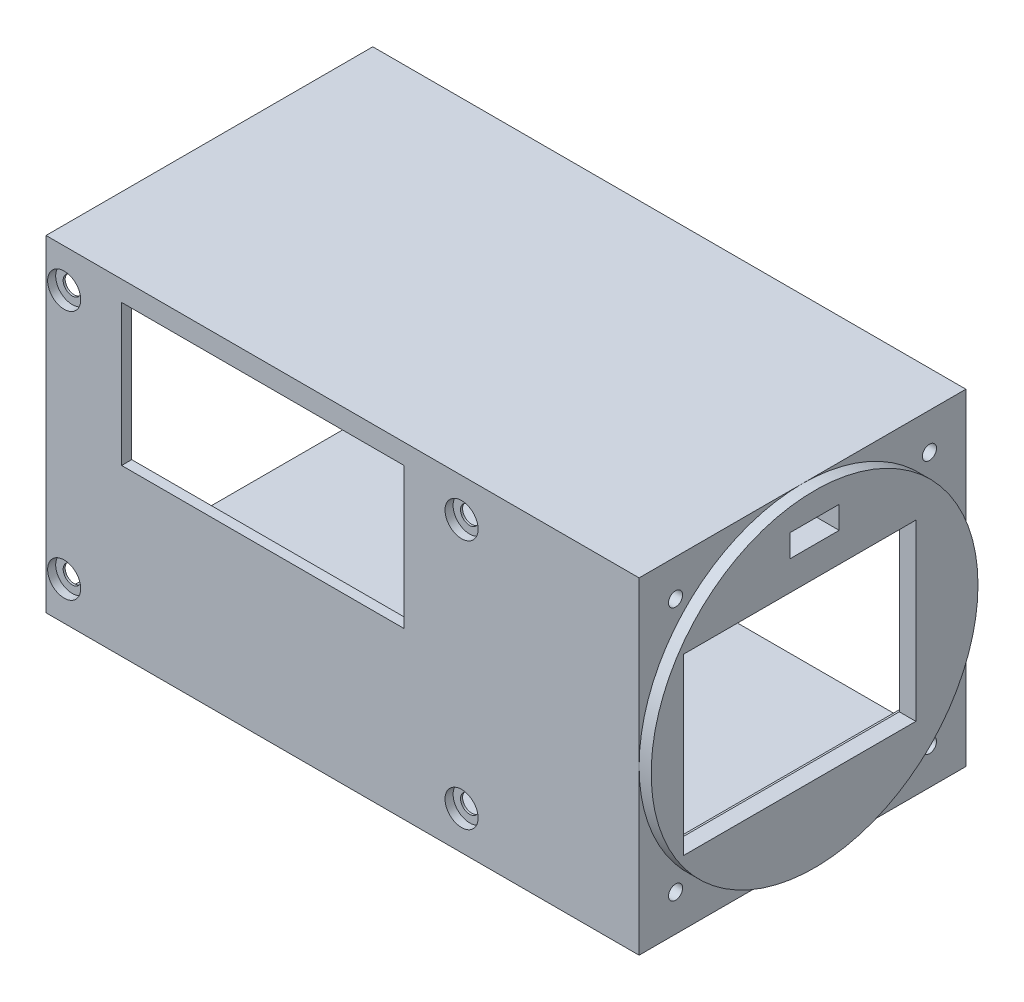
from build123d import *

# Parameters (mm, degrees)
SZKIC1_W                    = 57.6
SZKIC1_H                    = 43.2
DODANIE_WYCI_GNI_CIE1_DEPTH = 8
DODANIE_WYCI_GNI_CIE2_DEPTH = 5
SZKIC2_W                    = 69.32
SZKIC2_H                    = 50.12
SZKIC2_W_2                  = 57.6
SZKIC2_H_2                  = 43.2
WYTNIJ_WYCI_GNI_CIE1_DEPTH  = 3.9
SZKIC2_4_W                  = 81
SZKIC2_4_H                  = 81
SZKIC2_4_W_2                = 73.3
SZKIC2_4_H_2                = 55.32
DODANIE_WYCI_GNI_CIE3_DEPTH = 2
DODANIE_WYCI_GNI_CIE4_DEPTH = 140
WYTNIJ_WYCI_GNI_CIE2_REACH  = 184.445
SZKIC5_R                    = 2.25
SZKIC6_R                    = 4.1
WYTNIJ_WYCI_GNI_CIE3_DEPTH  = 2
WYTNIJ_WYCI_GNI_CIE4_REACH  = 184.445
SZKIC7_W                    = 70
SZKIC7_H                    = 35
WYTNIJ_WYCI_GNI_CIE5_REACH  = 188.363
SZKIC8_R                    = 1.75
WYTNIJ_WYCI_GNI_CIE6_REACH  = 190.738
SZKIC9_W                    = 12.2
SZKIC9_H                    = 5.6
SZKIC10_W                   = 140
SZKIC10_H                   = 78
WYTNIJ_WYCI_GNI_CIE7_DEPTH  = 0.5
SZKIC11_W                   = 140
SZKIC11_H                   = 78
WYTNIJ_WYCI_GNI_CIE8_DEPTH  = 0.5
WYTNIJ_WYCI_GNI_CIE9_DEPTH  = 0.5
WYTNIJ_WYCI_GNI_CIE10_DEPTH = 0.5


with BuildPart() as part:
    # Szkic1 → Dodanie-wyciągnięcie1 (new body)
    with BuildSketch(Plane(origin=(0, 0, 0), x_dir=(0, 0, -1), z_dir=(1, 0, 0))):
        with BuildLine():
            ThreePointArc((81, 40.5), (69.137824638, 69.137824638), (40.5, 81))
            ThreePointArc((40.5, 81), (11.862175362, 69.137824638), (0, 40.5))
            ThreePointArc((0, 40.5), (11.862175362, 11.862175362), (40.5, 0))
            ThreePointArc((40.5, 0), (69.137824638, 11.862175362), (81, 40.5))
        make_face()
        with Locations((36.8, 40.5)):
            Rectangle(SZKIC1_W, SZKIC1_H, mode=Mode.SUBTRACT)
    extrude(amount=DODANIE_WYCI_GNI_CIE1_DEPTH)

    # Szkic1<3> → Dodanie-wyciągnięcie2 (add)
    with BuildSketch(Plane(origin=(0, 0, 0), x_dir=(0, 0, -1), z_dir=(1, 0, 0))):
        with BuildLine():
            Line((40.5, 81), (0, 81))
            Line((0, 81), (0, 40.5))
            ThreePointArc((0, 40.5), (11.862175362, 69.137824638), (40.5, 81))
        make_face()
        with BuildLine():
            Line((81, 81), (40.5, 81))
            ThreePointArc((40.5, 81), (69.137824638, 69.137824638), (81, 40.5))
            Line((81, 40.5), (81, 81))
        make_face()
        with BuildLine():
            ThreePointArc((40.5, 0), (11.862175362, 11.862175362), (0, 40.5))
            Line((0, 40.5), (0, 0))
            Line((0, 0), (40.5, 0))
        make_face()
        with BuildLine():
            Line((81, 0), (81, 40.5))
            ThreePointArc((81, 40.5), (69.137824638, 11.862175362), (40.5, 0))
            Line((40.5, 0), (81, 0))
        make_face()
    extrude(amount=DODANIE_WYCI_GNI_CIE2_DEPTH)

    # Szkic2 → Wytnij-wyciągnięcie1 (cut)
    with BuildSketch(Plane.ZY):
        with Locations((-39.6, 40.5)):
            Rectangle(SZKIC2_W, SZKIC2_H)
        with Locations((-36.8, 40.5)):
            Rectangle(SZKIC2_W_2, SZKIC2_H_2, mode=Mode.SUBTRACT)
    extrude(amount=-WYTNIJ_WYCI_GNI_CIE1_DEPTH, mode=Mode.SUBTRACT)

    # Szkic2<4> → Dodanie-wyciągnięcie3 (add)
    with BuildSketch(Plane.ZY):
        with Locations((-40.5, 40.5)):
            Rectangle(SZKIC2_4_W, SZKIC2_4_H)
        with Locations((-39.65, 40.5)):
            Rectangle(SZKIC2_4_W_2, SZKIC2_4_H_2, mode=Mode.SUBTRACT)
    extrude(amount=DODANIE_WYCI_GNI_CIE3_DEPTH)

    # Szkic3 → Dodanie-wyciągnięcie4 (add)
    with BuildSketch(Plane.ZY.offset(2)):
        Polygon((-81, 0), (0, 0), (0, 81), (-81, 81), (-81, 78), (-3, 78), (-3, 3), (-81, 3), align=None)
    extrude(amount=DODANIE_WYCI_GNI_CIE4_DEPTH)

    # Szkic5 → Wytnij-wyciągnięcie2 (cut, up to next)
    with BuildSketch(Plane.XY, mode=Mode.PRIVATE) as wytnij_wyci_gni_cie2_sk1:
        with Locations((-137.5, 71.5)):
            Circle(SZKIC5_R)
    wytnij_wyci_gni_cie2_tool1 = extrude(wytnij_wyci_gni_cie2_sk1.sketch, amount=-WYTNIJ_WYCI_GNI_CIE2_REACH, mode=Mode.PRIVATE) & part.part
    # Szkic5 → Wytnij-wyciągnięcie2 (cut, up to next)
    with BuildSketch(Plane.XY, mode=Mode.PRIVATE) as wytnij_wyci_gni_cie2_sk2:
        with Locations((-39, 71.5)):
            Circle(SZKIC5_R)
    wytnij_wyci_gni_cie2_tool2 = extrude(wytnij_wyci_gni_cie2_sk2.sketch, amount=-WYTNIJ_WYCI_GNI_CIE2_REACH, mode=Mode.PRIVATE) & part.part
    # Szkic5 → Wytnij-wyciągnięcie2 (cut, up to next)
    with BuildSketch(Plane.XY, mode=Mode.PRIVATE) as wytnij_wyci_gni_cie2_sk3:
        with Locations((-137.5, 9.5)):
            Circle(SZKIC5_R)
    wytnij_wyci_gni_cie2_tool3 = extrude(wytnij_wyci_gni_cie2_sk3.sketch, amount=-WYTNIJ_WYCI_GNI_CIE2_REACH, mode=Mode.PRIVATE) & part.part
    # Szkic5 → Wytnij-wyciągnięcie2 (cut, up to next)
    with BuildSketch(Plane.XY, mode=Mode.PRIVATE) as wytnij_wyci_gni_cie2_sk4:
        with Locations((-39, 9.5)):
            Circle(SZKIC5_R)
    wytnij_wyci_gni_cie2_tool4 = extrude(wytnij_wyci_gni_cie2_sk4.sketch, amount=-WYTNIJ_WYCI_GNI_CIE2_REACH, mode=Mode.PRIVATE) & part.part
    add(wytnij_wyci_gni_cie2_tool1.solids().sort_by_distance((-137.5, 71.5, 0))[0], mode=Mode.SUBTRACT)
    add(wytnij_wyci_gni_cie2_tool2.solids().sort_by_distance((-39, 71.5, 0))[0], mode=Mode.SUBTRACT)
    add(wytnij_wyci_gni_cie2_tool3.solids().sort_by_distance((-137.5, 9.5, 0))[0], mode=Mode.SUBTRACT)
    add(wytnij_wyci_gni_cie2_tool4.solids().sort_by_distance((-39, 9.5, 0))[0], mode=Mode.SUBTRACT)

    # Szkic6 → Wytnij-wyciągnięcie3 (cut)
    with BuildSketch(Plane.XY):
        with Locations((-137.5, 71.5)):
            Circle(SZKIC6_R)
        with Locations((-39, 71.5)):
            Circle(SZKIC6_R)
        with Locations((-39, 9.5)):
            Circle(SZKIC6_R)
        with Locations((-137.5, 9.5)):
            Circle(SZKIC6_R)
    extrude(amount=-WYTNIJ_WYCI_GNI_CIE3_DEPTH, mode=Mode.SUBTRACT)

    # Szkic7 → Wytnij-wyciągnięcie4 (cut, up to next)
    with BuildSketch(Plane.XY, mode=Mode.PRIVATE) as wytnij_wyci_gni_cie4_sk1:
        with Locations((-88.25, 58.5)):
            Rectangle(SZKIC7_W, SZKIC7_H)
    wytnij_wyci_gni_cie4_tool1 = extrude(wytnij_wyci_gni_cie4_sk1.sketch, amount=-WYTNIJ_WYCI_GNI_CIE4_REACH, mode=Mode.PRIVATE) & part.part
    add(wytnij_wyci_gni_cie4_tool1.solids().sort_by_distance((-88.25, 58.5, 0))[0], mode=Mode.SUBTRACT)

    # Szkic8 → Wytnij-wyciągnięcie5 (cut, up to next)
    with BuildSketch(Plane(origin=(5, 0, 0), x_dir=(0, 0, -1), z_dir=(1, 0, 0)), mode=Mode.PRIVATE) as wytnij_wyci_gni_cie5_sk1:
        with Locations((9.033748237, 71.966251763)):
            Circle(SZKIC8_R)
    wytnij_wyci_gni_cie5_tool1 = extrude(wytnij_wyci_gni_cie5_sk1.sketch, amount=-WYTNIJ_WYCI_GNI_CIE5_REACH, mode=Mode.PRIVATE) & part.part
    # Szkic8 → Wytnij-wyciągnięcie5 (cut, up to next)
    with BuildSketch(Plane(origin=(5, 0, 0), x_dir=(0, 0, -1), z_dir=(1, 0, 0)), mode=Mode.PRIVATE) as wytnij_wyci_gni_cie5_sk2:
        with Locations((71.966251763, 71.966251763)):
            Circle(SZKIC8_R)
    wytnij_wyci_gni_cie5_tool2 = extrude(wytnij_wyci_gni_cie5_sk2.sketch, amount=-WYTNIJ_WYCI_GNI_CIE5_REACH, mode=Mode.PRIVATE) & part.part
    # Szkic8 → Wytnij-wyciągnięcie5 (cut, up to next)
    with BuildSketch(Plane(origin=(5, 0, 0), x_dir=(0, 0, -1), z_dir=(1, 0, 0)), mode=Mode.PRIVATE) as wytnij_wyci_gni_cie5_sk3:
        with Locations((71.966251763, 9.033748237)):
            Circle(SZKIC8_R)
    wytnij_wyci_gni_cie5_tool3 = extrude(wytnij_wyci_gni_cie5_sk3.sketch, amount=-WYTNIJ_WYCI_GNI_CIE5_REACH, mode=Mode.PRIVATE) & part.part
    # Szkic8 → Wytnij-wyciągnięcie5 (cut, up to next)
    with BuildSketch(Plane(origin=(5, 0, 0), x_dir=(0, 0, -1), z_dir=(1, 0, 0)), mode=Mode.PRIVATE) as wytnij_wyci_gni_cie5_sk4:
        with Locations((9.033748237, 9.033748237)):
            Circle(SZKIC8_R)
    wytnij_wyci_gni_cie5_tool4 = extrude(wytnij_wyci_gni_cie5_sk4.sketch, amount=-WYTNIJ_WYCI_GNI_CIE5_REACH, mode=Mode.PRIVATE) & part.part
    add(wytnij_wyci_gni_cie5_tool1.solids().sort_by_distance((5, 71.966252, -9.033748))[0], mode=Mode.SUBTRACT)
    add(wytnij_wyci_gni_cie5_tool2.solids().sort_by_distance((5, 71.966252, -71.966252))[0], mode=Mode.SUBTRACT)
    add(wytnij_wyci_gni_cie5_tool3.solids().sort_by_distance((5, 9.033748, -71.966252))[0], mode=Mode.SUBTRACT)
    add(wytnij_wyci_gni_cie5_tool4.solids().sort_by_distance((5, 9.033748, -9.033748))[0], mode=Mode.SUBTRACT)

    # Szkic9 → Wytnij-wyciągnięcie6 (cut, up to next)
    with BuildSketch(Plane(origin=(8, 0, 0), x_dir=(0, 0, -1), z_dir=(1, 0, 0)), mode=Mode.PRIVATE) as wytnij_wyci_gni_cie6_sk1:
        with Locations((40.5, 72.2)):
            Rectangle(SZKIC9_W, SZKIC9_H)
    wytnij_wyci_gni_cie6_tool1 = extrude(wytnij_wyci_gni_cie6_sk1.sketch, amount=-WYTNIJ_WYCI_GNI_CIE6_REACH, mode=Mode.PRIVATE) & part.part
    add(wytnij_wyci_gni_cie6_tool1.solids().sort_by_distance((8, 72.2, -40.5))[0], mode=Mode.SUBTRACT)

    # Szkic10 → Wytnij-wyciągnięcie7 (cut)
    with BuildSketch(Plane.XZ.offset(-78)):
        with Locations((-72, -42)):
            Rectangle(SZKIC10_W, SZKIC10_H)
    extrude(amount=-WYTNIJ_WYCI_GNI_CIE7_DEPTH, mode=Mode.SUBTRACT)

    # Szkic11 → Wytnij-wyciągnięcie8 (cut)
    with BuildSketch(Plane(origin=(0, 3, 0), x_dir=(1, 0, 0), z_dir=(0, 1, 0))):
        with Locations((-72, 42)):
            Rectangle(SZKIC11_W, SZKIC11_H)
    extrude(amount=-WYTNIJ_WYCI_GNI_CIE8_DEPTH, mode=Mode.SUBTRACT)

    # Szkic12 → Wytnij-wyciągnięcie9 (cut)
    with BuildSketch(Plane.ZY.offset(2)):
        Polygon((-81, 78.5), (-81, 2.5), (-3, 2.5), (-3, 12.84), (-76.3, 12.84), (-76.3, 68.16), (-3, 68.16), (-3, 78.5), align=None)
    extrude(amount=-WYTNIJ_WYCI_GNI_CIE9_DEPTH, mode=Mode.SUBTRACT)

    # Szkic13 → Wytnij-wyciągnięcie10 (cut)
    with BuildSketch(Plane(origin=(0, 0, -3), x_dir=(-1, 0, 0), z_dir=(0, 0, -1))):
        Polygon((1.5, 78.5), (1.5, 68.16), (0, 68.16), (0, 12.84), (1.5, 12.84), (1.5, 2.5), (142, 2.5), (142, 78.5), align=None)
    extrude(amount=-WYTNIJ_WYCI_GNI_CIE10_DEPTH, mode=Mode.SUBTRACT)


solid = part.part
